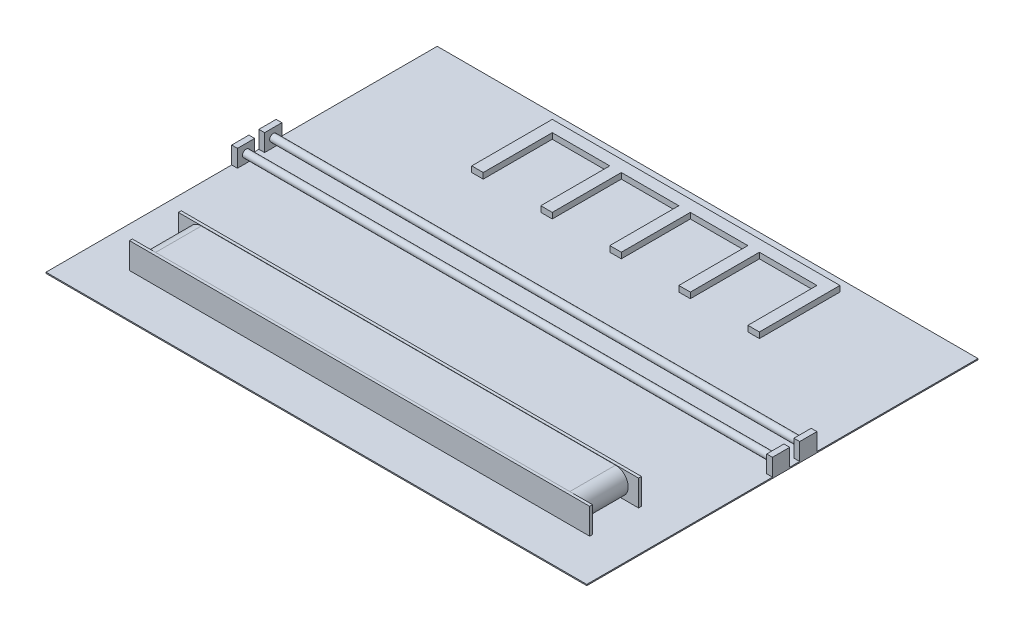
from build123d import *

# Parameters (mm, degrees)
SKETCH1_W                  = 1193.8
SKETCH1_H                  = 762
BOSS_EXTRUDE1_DEPTH        = 2.54
SKETCH2_W                  = 38.1
SKETCH2_H                  = 40.64
BOSS_EXTRUDE2_DEPTH        = 12.7
SKETCH3_W                  = 38.1
SKETCH3_H                  = 40.64
BOSS_EXTRUDE3_DEPTH        = 12.7
BOSS_EXTRUDE4_REACH        = 1243.696
SKETCH4_R                  = 8
BOSS_EXTRUDE5_DEPTH        = 50.8
BOSS_EXTRUDE5_DEPTH_BACK   = 50.8
SKETCH5_R                  = 25.4
BOSS_EXTRUDE5_2_DEPTH      = 50.8
BOSS_EXTRUDE5_2_DEPTH_BACK = 50.8
SKETCH6_W                  = 1016
SKETCH6_H                  = 57.15
BOSS_EXTRUDE6_DEPTH        = 6.35
BOSS_EXTRUDE8_DEPTH        = 101.6
SKETCH7_W                  = 1016
SKETCH7_H                  = 57.15
BOSS_EXTRUDE7_DEPTH        = 6.35
SKETCH12_W                 = 1193.8
SKETCH12_H                 = 2.54
BOSS_EXTRUDE9_DEPTH        = 101.6
BOSS_EXTRUDE10_DEPTH       = 12.7


with BuildPart() as part:
    # Sketch1 → Boss-Extrude1 (new body)
    with BuildSketch(Plane(origin=(0, 0, 0), x_dir=(1, 0, 0), z_dir=(0, 1, 0))):
        Rectangle(SKETCH1_W, SKETCH1_H)
    extrude(amount=BOSS_EXTRUDE1_DEPTH)

    # Sketch2 → Boss-Extrude2 (add)
    with BuildSketch(Plane.ZY.offset(596.9)):
        with Locations((-107.95, 20.32)):
            Rectangle(SKETCH2_W, SKETCH2_H)
        with Locations((-47.95, 20.32)):
            Rectangle(SKETCH2_W, SKETCH2_H)
    extrude(amount=-BOSS_EXTRUDE2_DEPTH)

    # Sketch3 → Boss-Extrude3 (add)
    with BuildSketch(Plane(origin=(596.9, 0, 0), x_dir=(0, 0, -1), z_dir=(1, 0, 0))):
        with Locations((47.95, 20.32)):
            Rectangle(SKETCH3_W, SKETCH3_H)
        with Locations((107.95, 20.32)):
            Rectangle(SKETCH3_W, SKETCH3_H)
    extrude(amount=-BOSS_EXTRUDE3_DEPTH)

    # Sketch4 → Boss-Extrude4 (add, up to next)
    with BuildSketch(Plane(origin=(-584.2, 0, 0), x_dir=(0, 0, -1), z_dir=(1, 0, 0)), mode=Mode.PRIVATE) as boss_extrude4_sk1:
        with Locations(Location((47.95, 21.59, 0), (0, 0, 180))):
            Circle(SKETCH4_R)
    boss_extrude4_tool1 = extrude(boss_extrude4_sk1.sketch, amount=BOSS_EXTRUDE4_REACH, mode=Mode.PRIVATE) - part.part
    # Sketch4 → Boss-Extrude4 (add, up to next)
    with BuildSketch(Plane(origin=(-584.2, 0, 0), x_dir=(0, 0, -1), z_dir=(1, 0, 0)), mode=Mode.PRIVATE) as boss_extrude4_sk2:
        with Locations((107.95, 21.59)):
            Circle(SKETCH4_R)
    boss_extrude4_tool2 = extrude(boss_extrude4_sk2.sketch, amount=BOSS_EXTRUDE4_REACH, mode=Mode.PRIVATE) - part.part
    add(boss_extrude4_tool1.solids().sort_by_distance((-584.2, 21.59, -47.95))[0])
    add(boss_extrude4_tool2.solids().sort_by_distance((-584.2, 21.59, -107.95))[0])



with BuildPart() as body_2:
    # Sketch5 → Boss-Extrude5 (new, two sides: drawn at the far end of the back side and taken through both)
    with BuildSketch(Plane.XY.offset(228.6).offset(-BOSS_EXTRUDE5_DEPTH_BACK)):
        with Locations((-457.2, 31.115)):
            Circle(SKETCH5_R)
    extrude(amount=BOSS_EXTRUDE5_DEPTH + BOSS_EXTRUDE5_DEPTH_BACK)


with BuildPart() as body_3:
    # Sketch5 → Boss-Extrude5 2 (new, two sides: drawn at the far end of the back side and taken through both)
    with BuildSketch(Plane.XY.offset(228.6).offset(-BOSS_EXTRUDE5_2_DEPTH_BACK)):
        with Locations(Location((457.2, 31.115, 0), (0, 0, 180))):
            Circle(SKETCH5_R)
    extrude(amount=BOSS_EXTRUDE5_2_DEPTH + BOSS_EXTRUDE5_2_DEPTH_BACK)


with BuildPart() as part_1:
    add(part.part)

    add(body_2.part)  # Boss-Extrude6 merges body 2
    # Sketch6 → Boss-Extrude6 (add)
    with BuildSketch(Plane.XY.offset(279.4)):
        with Locations((0, 31.115)):
            Rectangle(SKETCH6_W, SKETCH6_H)
    extrude(amount=BOSS_EXTRUDE6_DEPTH)


with BuildPart() as body_3_2:
    # Sketch11 → Boss-Extrude8 (new body)
    with BuildSketch(Plane(origin=(0, 0, 279.4), x_dir=(-1, 0, 0), z_dir=(0, 0, -1))):
        with BuildLine():
            Line((-457.2, 59.055), (457.2, 59.055))
            ThreePointArc((457.2, 59.055), (485.14, 31.115), (457.2, 3.175))
            Line((457.2, 3.175), (-457.2, 3.175))
            ThreePointArc((-457.2, 3.175), (-485.14, 31.115), (-457.2, 59.055))
        make_face()
        with BuildLine():
            Line((-457.2, 57.015), (457.2, 57.015))
            ThreePointArc((457.2, 57.015), (483.1, 31.115), (457.2, 5.215))
            Line((457.2, 5.215), (-457.2, 5.215))
            ThreePointArc((-457.2, 5.215), (-483.1, 31.115), (-457.2, 57.015))
        make_face(mode=Mode.SUBTRACT)
    extrude(amount=BOSS_EXTRUDE8_DEPTH)

    # Sketch7 → Boss-Extrude7 (add)
    with BuildSketch(Plane(origin=(0, 0, 177.8), x_dir=(-1, 0, 0), z_dir=(0, 0, -1))):
        with Locations((0, 31.115)):
            Rectangle(SKETCH7_W, SKETCH7_H)
    extrude(amount=BOSS_EXTRUDE7_DEPTH)


with BuildPart() as body_4:
    # Sketch12 → Boss-Extrude9 (new body)
    with BuildSketch(Plane(origin=(0, 0, -381), x_dir=(-1, 0, 0), z_dir=(0, 0, -1))):
        with Locations((0, 1.27)):
            Rectangle(SKETCH12_W, SKETCH12_H)
    extrude(amount=BOSS_EXTRUDE9_DEPTH)

    # Combine1: union part
    add(part_1.part)


with BuildPart() as body_5:
    # Sketch13 → Boss-Extrude10 (new body)
    with BuildSketch(Plane(origin=(0, 2.54, 0), x_dir=(1, 0, 0), z_dir=(0, 1, 0))):
        Polygon((317.5, 279.4), (317.5, 457.2), (-317.5, 457.2), (-317.5, 279.4), (-292.1, 279.4), (-292.1, 431.8), (-165.1, 431.8), (-165.1, 279.4), (-139.7, 279.4), (-139.7, 431.8), (-12.7, 431.8), (-12.7, 279.4), (12.7, 279.4), (12.7, 431.8), (139.7, 431.8), (139.7, 279.4), (165.1, 279.4), (165.1, 431.8), (292.1, 431.8), (292.1, 279.4), align=None)
    extrude(amount=BOSS_EXTRUDE10_DEPTH)


solid = Compound([body_3.part, body_3_2.part, body_4.part, body_5.part])
